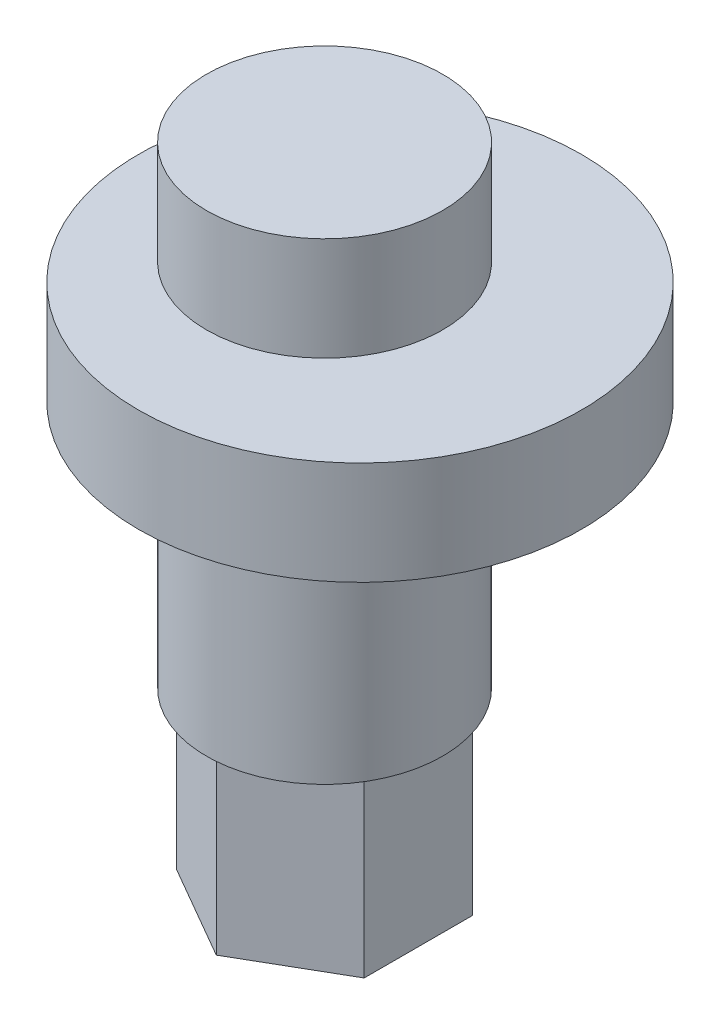
from build123d import *

# Parameters (mm, degrees)
SKETCH3_R           = 7.5
BOSS_EXTRUDE1_DEPTH = 3.5
SKETCH4_R           = 4
BOSS_EXTRUDE2_DEPTH = 15
BOSS_EXTRUDE4_START = 3.5
SKETCH6_R           = 4
BOSS_EXTRUDE4_DEPTH = 3.5
SKETCH7_OUTSIDE_W   = 23.112
SKETCH7_OUTSIDE_H   = 23.112
CUT_EXTRUDE1_DEPTH  = 6


with BuildPart() as part:
    # Sketch3 → Boss-Extrude1 (new body)
    with BuildSketch(Plane(origin=(0, 0, 0), x_dir=(1, 0, 0), z_dir=(0, 1, 0))):
        with Locations(Location((1.2, 0, 0), (0, 0, 270))):
            Circle(SKETCH3_R)
    extrude(amount=BOSS_EXTRUDE1_DEPTH)

    # Sketch4 → Boss-Extrude2 (add)
    with BuildSketch(Plane.XZ):
        with Locations(Location((0, 0, 0), (0, 0, 270))):
            Circle(SKETCH4_R)
    extrude(amount=BOSS_EXTRUDE2_DEPTH)

    # Sketch6 → Boss-Extrude4 (add)
    with BuildSketch(Plane(origin=(0, 3.5, 0), x_dir=(1, 0, 0), z_dir=(0, 1, 0)).offset(BOSS_EXTRUDE4_START)):
        with Locations(Location((0, 0, 0), (0, 0, 90))):
            Circle(SKETCH6_R)
    extrude(amount=-BOSS_EXTRUDE4_DEPTH)

    # Sketch7 outside → Cut-Extrude1 (cut)
    with BuildSketch(Plane.XZ.offset(15)):
        with Locations((1.2, 0)):
            Rectangle(SKETCH7_OUTSIDE_W, SKETCH7_OUTSIDE_H)
        Polygon((0, 3.666174209), (-3.175, 1.833087105), (-3.175, -1.833087105), (0, -3.666174209), (3.175, -1.833087105), (3.175, 1.833087105), align=None, mode=Mode.SUBTRACT)
    extrude(amount=-CUT_EXTRUDE1_DEPTH, mode=Mode.SUBTRACT)


solid = part.part
